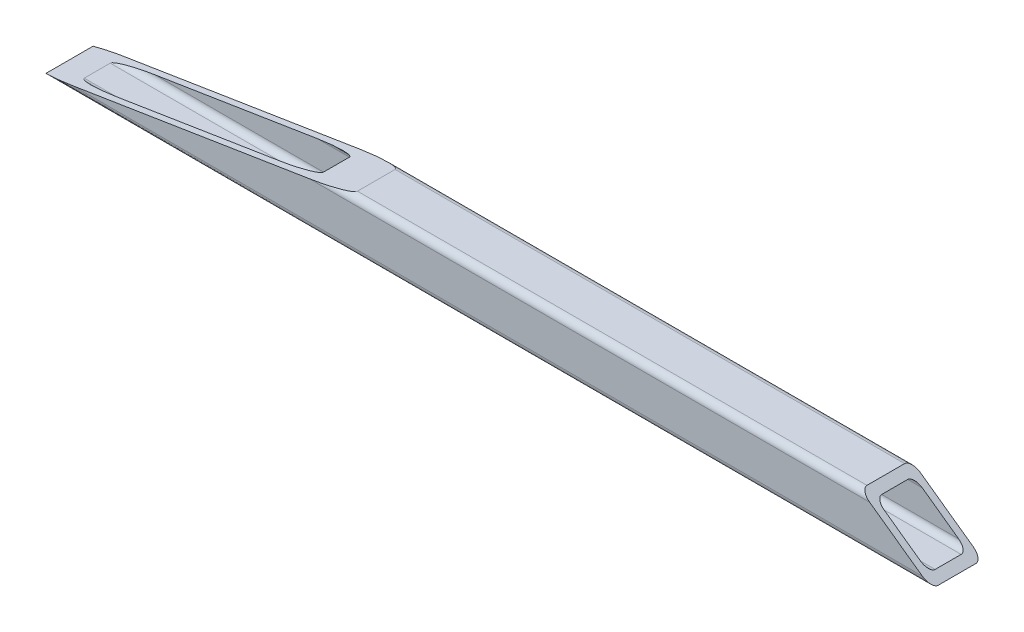
from build123d import *

# Parameters (mm, degrees)
BOSS_EXTRUDE1_DEPTH = 442.722
CUT_EXTRUDE1_DEPTH  = 445.122611735


with BuildPart() as part:
    # Sketch1 → Boss-Extrude1 (new body)
    with BuildSketch(Plane(origin=(0, 0, 0), x_dir=(0, 0, -1), z_dir=(1, 0, 0))):
        with BuildLine():
            Line((2.334866591, -0.967133409), (21.130866591, -0.967133409))
            ThreePointArc((21.130866591, -0.967133409), (23.465733183, 0), (24.432866591, 2.334866591))
            Line((24.432866591, 2.334866591), (24.432866591, 21.130866591))
            ThreePointArc((24.432866591, 21.130866591), (23.465733183, 23.465733183), (21.130866591, 24.432866591))
            Line((21.130866591, 24.432866591), (2.334866591, 24.432866591))
            ThreePointArc((2.334866591, 24.432866591), (0, 23.465733183), (-0.967133409, 21.130866591))
            Line((-0.967133409, 21.130866591), (-0.967133409, 2.334866591))
            ThreePointArc((-0.967133409, 2.334866591), (0, 0), (2.334866591, -0.967133409))
        make_face()
        with BuildLine():
            Line((5.255866591, 2.207866591), (18.209866591, 2.207866591))
            ThreePointArc((18.209866591, 2.207866591), (20.365128061, 3.100605122), (21.257866591, 5.255866591))
            Line((21.257866591, 5.255866591), (21.257866591, 18.209866591))
            ThreePointArc((21.257866591, 18.209866591), (20.365128061, 20.365128061), (18.209866591, 21.257866591))
            Line((18.209866591, 21.257866591), (5.255866591, 21.257866591))
            ThreePointArc((5.255866591, 21.257866591), (3.100605122, 20.365128061), (2.207866591, 18.209866591))
            Line((2.207866591, 18.209866591), (2.207866591, 5.255866591))
            ThreePointArc((2.207866591, 5.255866591), (3.100605122, 3.100605122), (5.255866591, 2.207866591))
        make_face(mode=Mode.SUBTRACT)
    extrude(amount=BOSS_EXTRUDE1_DEPTH)

    # Sketch3 → Cut-Extrude1 (cut, through all)
    with BuildSketch(Plane.XY.offset(0.967133409)):
        Polygon((0, 0), (153.035, 24.432866591), (0, 24.432866591), align=None)
        Polygon((442.722, 24.432866591), (442.722, -0.967133409), (407.176517249, 24.432866591), align=None)
    extrude(amount=-CUT_EXTRUDE1_DEPTH, mode=Mode.SUBTRACT)


solid = part.part
